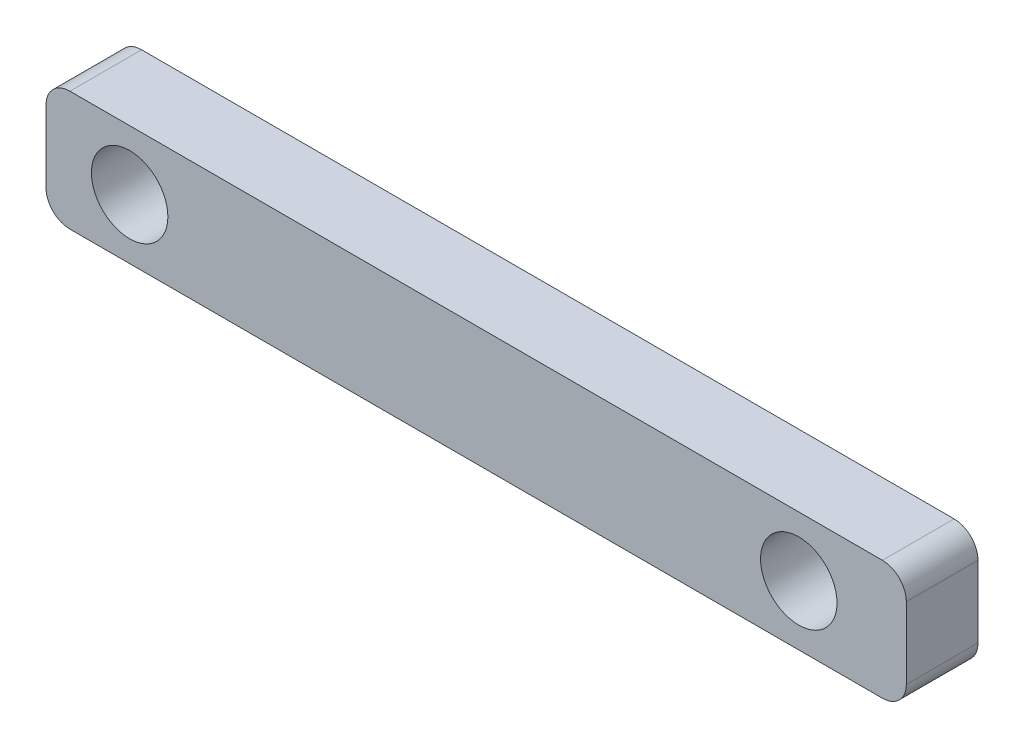
from build123d import *

# Parameters (mm, degrees)
SKETCH_1_R      = 1.6
EXTRUDE_1_DEPTH = 3


with BuildPart() as part:
    # 草圖1 → 填料-伸長1 (new body)
    with BuildSketch(Plane.XY):
        with BuildLine():
            Line((12.825055765, -7.385523585), (46.825055765, -7.385523585))
            ThreePointArc((46.825055765, -7.385523585), (47.532162546, -7.678416804), (47.825055765, -8.385523585))
            Line((47.825055765, -8.385523585), (47.825055765, -11.385523585))
            ThreePointArc((47.825055765, -11.385523585), (47.532162546, -12.092630366), (46.825055765, -12.385523585))
            Line((46.825055765, -12.385523585), (12.825055765, -12.385523585))
            ThreePointArc((12.825055765, -12.385523585), (12.117948984, -12.092630366), (11.825055765, -11.385523585))
            Line((11.825055765, -11.385523585), (11.825055765, -8.385523585))
            ThreePointArc((11.825055765, -8.385523585), (12.117948984, -7.678416804), (12.825055765, -7.385523585))
        make_face()
        with Locations((15.325055765, -9.885523585)):
            Circle(SKETCH_1_R, mode=Mode.SUBTRACT)
        with Locations((43.325055765, -9.885523585)):
            Circle(SKETCH_1_R, mode=Mode.SUBTRACT)
    extrude(amount=EXTRUDE_1_DEPTH)


solid = part.part
